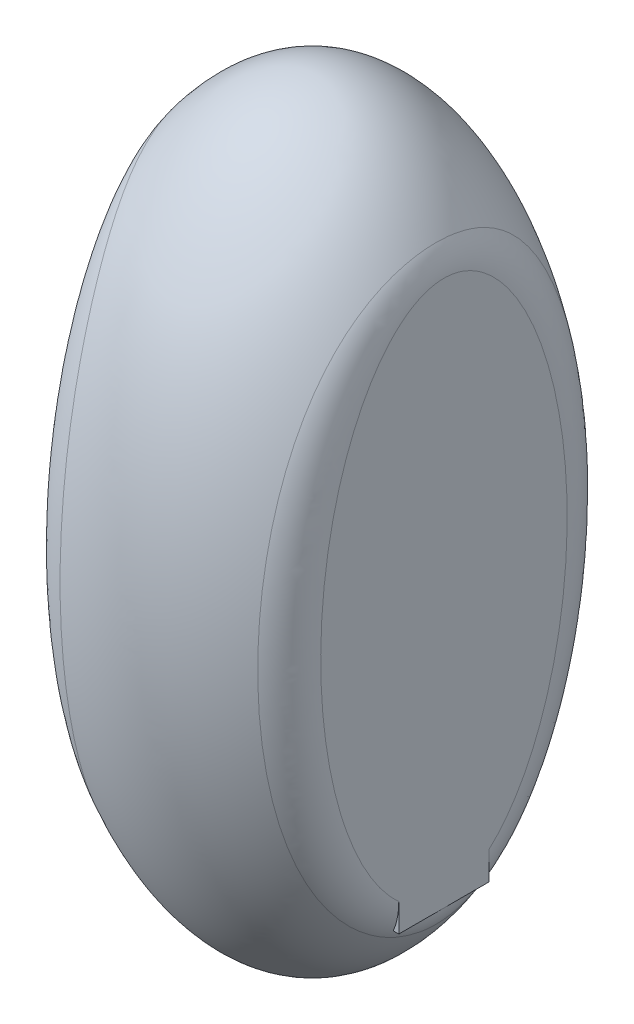
from build123d import *

# Parameters (mm, degrees)
CUT_EXTRUDE1_DEPTH      = 2.429160757
CUT_EXTRUDE1_DEPTH_BACK = 2.429160757
SKETCH2_W               = 0.495028532
SKETCH2_H               = 2.534111579
SKETCH2_W_2             = 0.630036314
FILLET1_R               = 0.15
BOSS_EXTRUDE5_DEPTH     = 0.5
FILLET2_R               = 0.3
SKETCH4_W               = 0.2
SKETCH4_H               = 0.02
BOSS_EXTRUDE6_DEPTH     = 0.01


with BuildPart() as part:
    # Sketch1 → Revolve6 (revolve)
    with BuildSketch(Plane.XY):
        with BuildLine():
            Line((0, 1.15), (0, -1.15))
            add(Edge.make_bspline(
                [(0, -1.15), (0.6, -1.15), (0.6, 0), (0.6, 1.15), (0, 1.15)],
                knots=[3.141592654, 3.141592654, 3.141592654, 4.71238898, 4.71238898, 6.283185307, 6.283185307, 6.283185307], degree=2, weights=[1, 0.707106781, 1, 0.707106781, 1]))
        make_face()
    revolve(axis=Axis((0, 1.15, 0), (0, -1, 0)))

    # Sketch2 → Cut-Extrude1 (cut, two sides: drawn at the far end of the back side and taken through both)
    with BuildSketch(Plane.XY.offset(-CUT_EXTRUDE1_DEPTH_BACK)):
        with Locations((-0.647514266, -0.090005188)):
            Rectangle(SKETCH2_W, SKETCH2_H)
        with Locations((0.715018157, -0.090005188)):
            Rectangle(SKETCH2_W_2, SKETCH2_H)
    extrude(amount=CUT_EXTRUDE1_DEPTH + CUT_EXTRUDE1_DEPTH_BACK, mode=Mode.SUBTRACT)

    # Fillet1
    fillet1_edges = [part.edges().sort_by_distance(p)[0] for p in [
        (0.4, 0, -0.447213596),
    ]]
    fillet(fillet1_edges, radius=FILLET1_R)

    # Sketch3 → Boss-Extrude5 (add)
    with BuildSketch(Plane(origin=(0.4, 0, 0), x_dir=(0, 0, -1), z_dir=(1, 0, 0))):
        Polygon((-0.137119625, -0.755402074), (-0.137119625, -0.841264635), (0.137119625, -0.841264635), (0.137126183, -0.755402074), align=None)
    extrude(amount=-BOSS_EXTRUDE5_DEPTH)

    # Fillet2
    fillet2_edges = [part.edges().sort_by_distance(p)[0] for p in [
        (-0.4, 0.81061376, -0.145365497),
    ]]
    fillet(fillet2_edges, radius=FILLET2_R)

    # Sketch4 → Boss-Extrude6 (add)
    with BuildSketch(Plane.ZY.offset(0.4)):
        with Locations((0, -0.338938886)):
            Rectangle(SKETCH4_W, SKETCH4_H)
    extrude(amount=BOSS_EXTRUDE6_DEPTH)


solid = part.part
